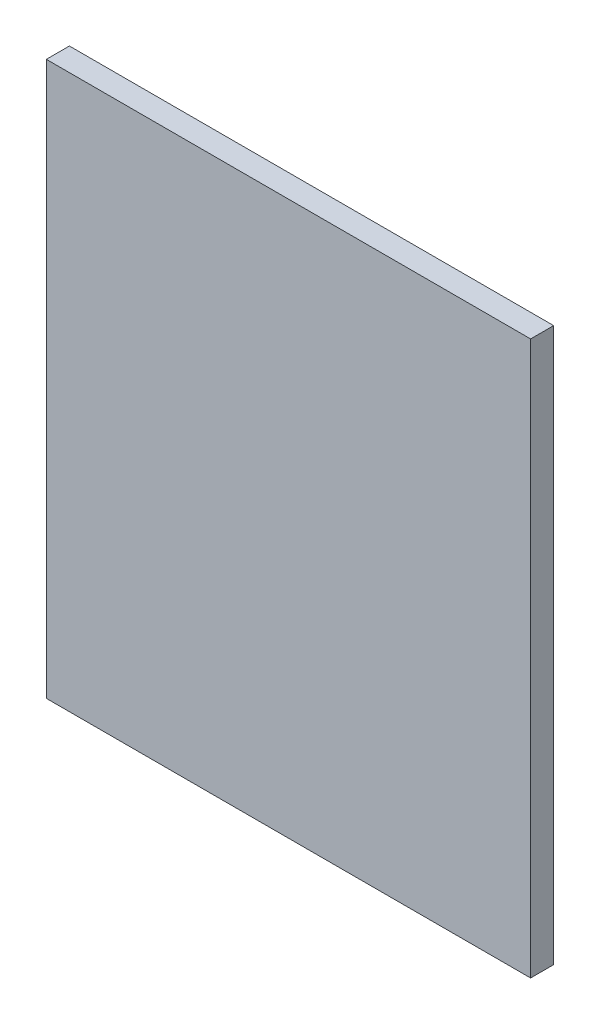
from build123d import *

# Parameters (mm, degrees)
SKETCH1_W           = 105
SKETCH1_H           = 120
BOSS_EXTRUDE1_DEPTH = 5


with BuildPart() as part:
    # Sketch1 → Boss-Extrude1 (new body)
    with BuildSketch(Plane.XY):
        with Locations((0, 60)):
            Rectangle(SKETCH1_W, SKETCH1_H)
    extrude(amount=BOSS_EXTRUDE1_DEPTH)


solid = part.part
